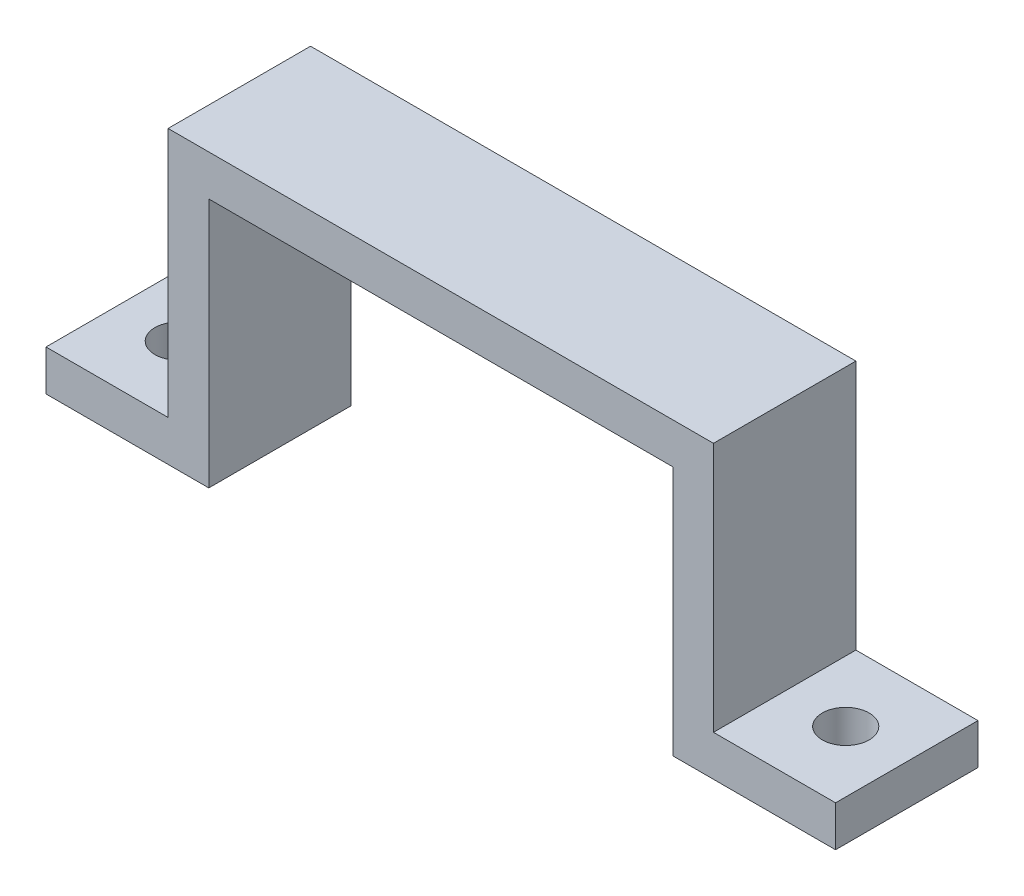
from build123d import *

# Parameters (mm, degrees)
BOSS_EXTRUDE1_DEPTH = 7
SKETCH2_R           = 1.15
CUT_EXTRUDE1_DEPTH  = 7


with BuildPart() as part:
    # Sketch1 → Boss-Extrude1 (new body)
    with BuildSketch(Plane.XY):
        Polygon((0, 0), (8, 0), (8, 12.3), (30.8, 12.3), (30.8, 0), (38.8, 0), (38.8, 2), (32.8, 2), (32.8, 14.3), (6, 14.3), (6, 2), (0, 2), align=None)
    extrude(amount=BOSS_EXTRUDE1_DEPTH)

    # Sketch2 → Cut-Extrude1 (cut)
    with BuildSketch(Plane(origin=(0, 2, 0), x_dir=(1, 0, 0), z_dir=(0, 1, 0))):
        with Locations(Location((35.8, -3.5, 0), (0, 0, 180))):
            Circle(SKETCH2_R)
        with Locations(Location((3, -3.5, 0), (0, 0, 180))):
            Circle(SKETCH2_R)
    extrude(amount=-CUT_EXTRUDE1_DEPTH, mode=Mode.SUBTRACT)


solid = part.part
